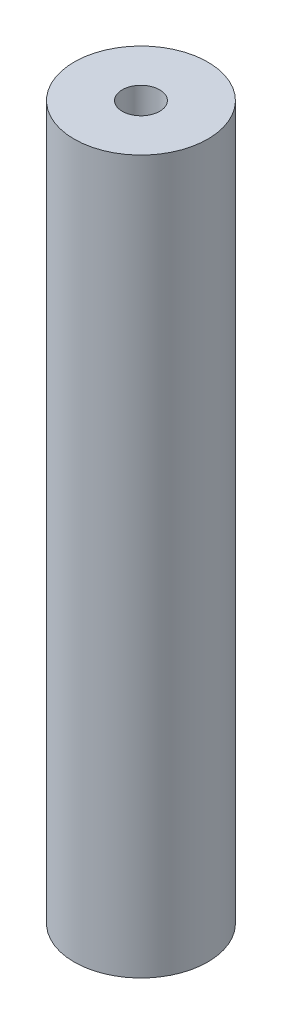
from build123d import *

# Parameters (mm, degrees)
SKETCH1_R           = 7.5
SKETCH1_R_2         = 2.1
BOSS_EXTRUDE1_DEPTH = 80


with BuildPart() as part:
    # Sketch1 → Boss-Extrude1 (new body)
    with BuildSketch(Plane(origin=(0, 0, 0), x_dir=(1, 0, 0), z_dir=(0, 1, 0))):
        with Locations(Location((0, 0, 0), (0, 0, 270))):
            Circle(SKETCH1_R)
        with Locations(Location((0, 0, 0), (0, 0, 270))):
            Circle(SKETCH1_R_2, mode=Mode.SUBTRACT)
    extrude(amount=BOSS_EXTRUDE1_DEPTH)


solid = part.part
